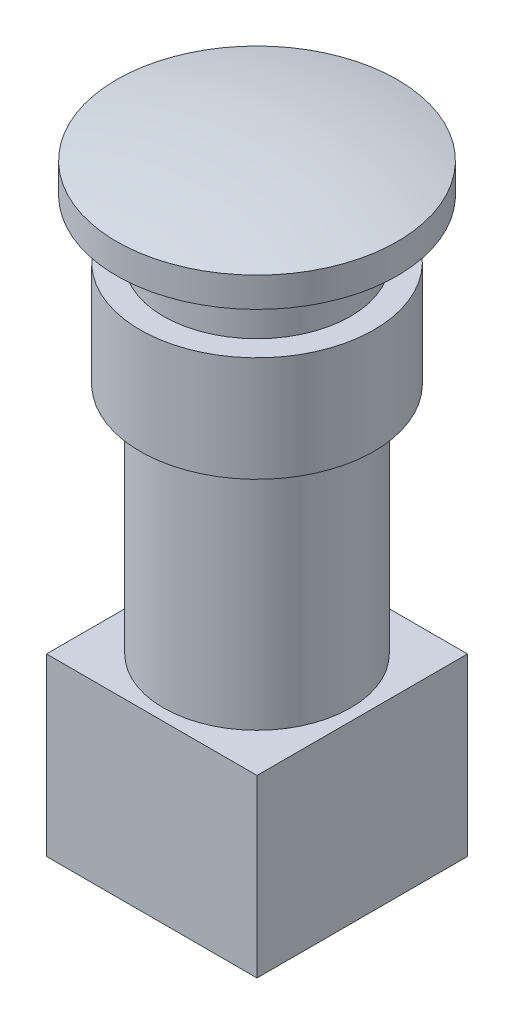
from build123d import *

# Parameters (mm, degrees)
ESQUISSE2_W      = 18
ESQUISSE2_H      = 18
EXTRUSION1_DEPTH = 15


with BuildPart() as part:
    # Esquisse1 → Révolution1 (revolve)
    with BuildSketch(Plane.XY, mode=Mode.PRIVATE) as r_volution1_sk:
        with BuildLine():
            Line((-12, 36.538644398), (-12, 34))
            Line((-12, 34), (-8, 34))
            Line((-8, 34), (-8, 29))
            Line((-8, 29), (-10, 29))
            Line((-10, 29), (-10, 20))
            Line((-10, 20), (-8, 20))
            Line((-8, 20), (-8, 0))
            Line((-8, 0), (0, 0))
            Line((0, 0), (0, 38))
            ThreePointArc((0, 38), (-6.044327096, 37.633316532), (-12, 36.538644398))
        make_face()
    revolve(r_volution1_sk.sketch.rotate(Axis((0, 0, 0), (0, 1, 0)), 270), axis=Axis((0, 0, 0), (0, 1, 0)))

    # Esquisse2 → Extrusion1 (add)
    with BuildSketch(Plane.XZ):
        Rectangle(ESQUISSE2_W, ESQUISSE2_H)
    extrude(amount=EXTRUSION1_DEPTH)


solid = part.part
